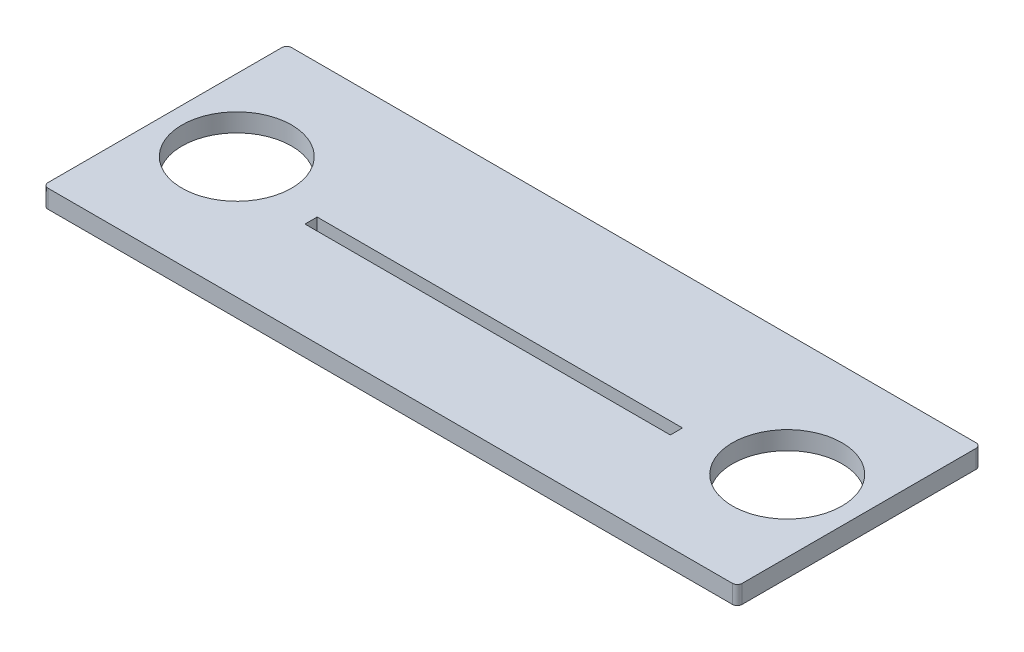
from build123d import *

# Parameters (mm, degrees)
SKETCH1_W               = 285
SKETCH1_H               = 100
BOSS_EXTRUDE1_DEPTH     = 7.5
CUT_EXTRUDE1_DEPTH      = 152.20350525
CUT_EXTRUDE1_DEPTH_BACK = 10
SKETCH2_R               = 22.5
SKETCH2_W               = 150
SKETCH2_H               = 5
FILLET1_R               = 2


with BuildPart() as part:
    # Sketch1 → Boss-Extrude1 (new body)
    with BuildSketch(Plane(origin=(0, 0, 0), x_dir=(1, 0, 0), z_dir=(0, 1, 0))):
        Rectangle(SKETCH1_W, SKETCH1_H)
    extrude(amount=BOSS_EXTRUDE1_DEPTH)

    # Sketch2 → Cut-Extrude1 (cut, two sides: drawn at the far end of the back side and taken through both)
    with BuildSketch(Plane(origin=(0, 7.5, 0), x_dir=(1, 0, 0), z_dir=(0, 1, 0)).offset(-CUT_EXTRUDE1_DEPTH_BACK)):
        with Locations(Location((-113, 0, 0), (0, 0, 90))):
            Circle(SKETCH2_R)
        with Locations(Location((113, 0, 0), (0, 0, 90))):
            Circle(SKETCH2_R)
        with Locations((0, -7.5)):
            Rectangle(SKETCH2_W, SKETCH2_H)
    extrude(amount=CUT_EXTRUDE1_DEPTH + CUT_EXTRUDE1_DEPTH_BACK, mode=Mode.SUBTRACT)

    # Fillet1
    fillet1_edges = [part.edges().sort_by_distance(p)[0] for p in [
        (142.5, 3.75, 50),
        (-142.5, 3.75, 50),
        (-142.5, 3.75, -50),
        (142.5, 3.75, -50),
    ]]
    fillet(fillet1_edges, radius=FILLET1_R)


solid = part.part
